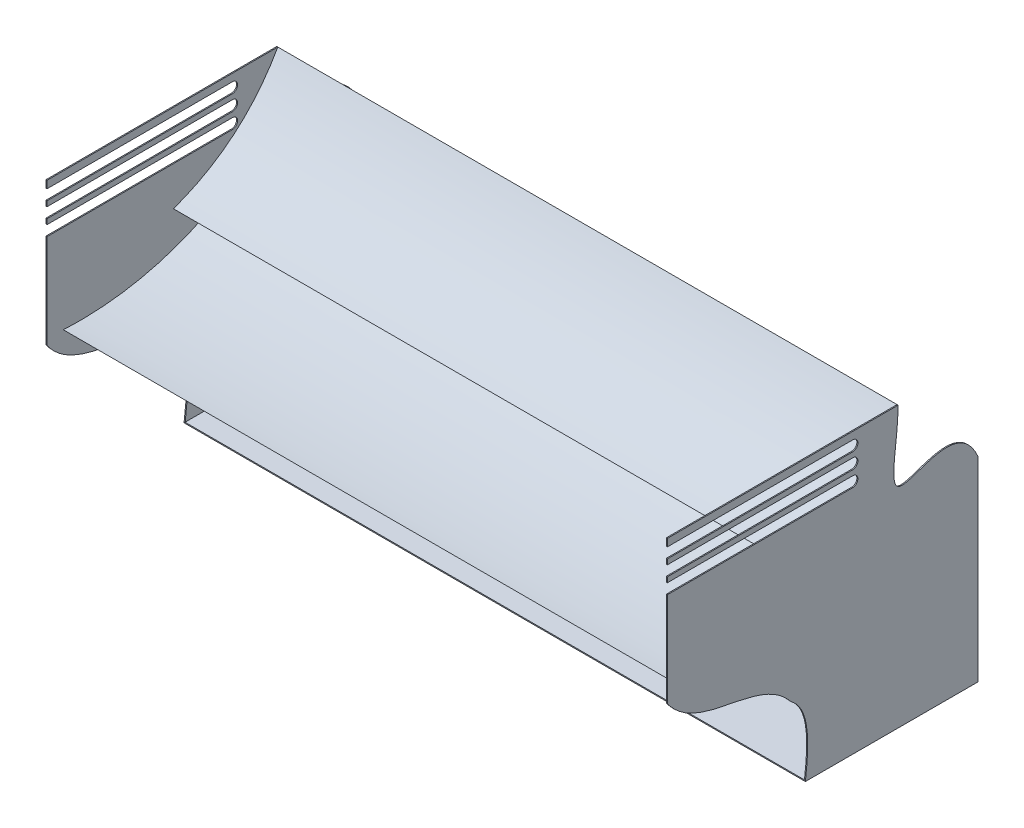
from build123d import *

# Parameters (mm, degrees)
BOSS_EXTRUDE1_START        = 762
BOSS_EXTRUDE1_DEPTH        = 2.54
BOSS_EXTRUDE3_DEPTH        = 759.46
BOSS_EXTRUDE3_DEPTH_BACK   = 762
BOSS_EXTRUDE3_2_DEPTH      = 759.46
BOSS_EXTRUDE3_2_DEPTH_BACK = 762
SKETCH13_W                 = 1524
SKETCH13_H                 = 423.429853573
BOSS_EXTRUDE4_DEPTH        = 2.54
CUT_EXTRUDE1_DEPTH         = 1278.344761778
CUT_EXTRUDE1_DEPTH_BACK    = 1278.344761778
CUT_EXTRUDE2_DEPTH         = 1278.344761778
CUT_EXTRUDE2_DEPTH_BACK    = 1278.344761778


with BuildPart() as part:
    # Sketch3 → Boss-Extrude1 (new body)
    with BuildSketch(Plane(origin=(0, 0, 0), x_dir=(0, 0, -1), z_dir=(1, 0, 0)).offset(BOSS_EXTRUDE1_START)):
        with BuildLine():
            Line((338.570146427, 0), (762, 0))
            Line((762, 0), (762, 478.643823899))
            add(Edge.make_bspline(
                [(566.02119263, 685.8), (566.02119263, 609.562833411), (511.018643959, 418.064816879), (711.566045078, 596.214023542), (762, 478.643823899)],
                knots=[0, 0, 0, 0, 0.43337684, 1, 1, 1, 1], degree=3))
            Line((566.02119263, 685.8), (0, 685.8))
            Line((0, 685.8), (0, 216.97447871))
            add(Edge.make_bspline(
                [(0, 216.97447871), (268.153594246, 216.97447871), (370.795901917, 243.07894269), (338.570146427, 0)],
                knots=[0, 0, 0, 0, 1, 1, 1, 1], degree=3))
        make_face()
    extrude(amount=-BOSS_EXTRUDE1_DEPTH)


with BuildPart() as body_2:
    # Mirror1: mirrored copy
    add(part.part.mirror(Plane(origin=(0, 0, 0), x_dir=(0, 0, 1), z_dir=(1, 0, 0))))


with BuildPart() as body_3:
    # Sketch8 → Boss-Extrude3 (new, two sides: drawn at the far end of the back side and taken through both)
    with BuildSketch(Plane(origin=(0, 0, 0), x_dir=(0, 0, -1), z_dir=(1, 0, 0)).offset(-BOSS_EXTRUDE3_DEPTH_BACK)):
        with BuildLine():
            add(Edge.make_bspline(
                [(566.02119263, 685.8), (478.94605907, 530.59259106), (310.041791286, 470.260887435)],
                knots=[0, 0, 0, 1, 1, 1], degree=2))
            add(Edge.make_bspline(
                [(566.02119263, 685.8), (535.192963113, 473.791997419), (310.041791286, 470.260887435)],
                knots=[0, 0, 0, 1, 1, 1], degree=2))
        make_face()
    extrude(amount=BOSS_EXTRUDE3_DEPTH + BOSS_EXTRUDE3_DEPTH_BACK)


with BuildPart() as body_4:
    # Sketch8 → Boss-Extrude3 2 (new, two sides: drawn at the far end of the back side and taken through both)
    with BuildSketch(Plane(origin=(0, 0, 0), x_dir=(0, 0, -1), z_dir=(1, 0, 0)).offset(-BOSS_EXTRUDE3_2_DEPTH_BACK)):
        with BuildLine():
            add(Edge.make_bspline(
                [(493.805357443, 481.17753493), (291.820165627, 335.217986135), (39.854765798, 348.358323747)],
                knots=[0, 0, 0, 1, 1, 1], degree=2))
            add(Edge.make_bspline(
                [(493.805357443, 481.17753493), (323.598432885, 237.863082713), (39.854765798, 348.358323747)],
                knots=[0, 0, 0, 1, 1, 1], degree=2))
        make_face()
    extrude(amount=BOSS_EXTRUDE3_2_DEPTH + BOSS_EXTRUDE3_2_DEPTH_BACK)


with BuildPart() as part_1:
    add(part.part)

    add(body_2.part)  # Boss-Extrude4 merges body 2
    # Sketch13 → Boss-Extrude4 (add)
    with BuildSketch(Plane(origin=(0, 0, 0), x_dir=(1, 0, 0), z_dir=(0, 1, 0))):
        with Locations((0, 550.285073214)):
            Rectangle(SKETCH13_W, SKETCH13_H)
    extrude(amount=BOSS_EXTRUDE4_DEPTH)

    # Sketch16 → Cut-Extrude1 (cut, two sides: drawn at the far end of the back side and taken through both)
    with BuildSketch(Plane(origin=(0, 0, 0), x_dir=(0, 0, -1), z_dir=(1, 0, 0)).offset(-CUT_EXTRUDE1_DEPTH_BACK)):
        with BuildLine():
            Line((0, 667.670249742), (454.687424311, 667.670249742))
            ThreePointArc((454.687424311, 667.670249742), (467.387424311, 654.970249742), (454.687424311, 642.270249742))
            Line((454.687424311, 642.270249742), (0, 642.270249742))
            ThreePointArc((0, 642.270249742), (-12.7, 654.970249742), (0, 667.670249742))
        make_face()
        with BuildLine():
            Line((0, 604.170249742), (454.687424311, 604.170249742))
            ThreePointArc((454.687424311, 604.170249742), (467.387424311, 616.870249742), (454.687424311, 629.570249742))
            Line((454.687424311, 629.570249742), (0, 629.570249742))
            ThreePointArc((0, 629.570249742), (-12.7, 616.870249742), (0, 604.170249742))
        make_face()
        with BuildLine():
            Line((0, 566.070249742), (454.687424311, 566.070249742))
            ThreePointArc((454.687424311, 566.070249742), (467.387424311, 578.770249742), (454.687424311, 591.470249742))
            Line((454.687424311, 591.470249742), (0, 591.470249742))
            ThreePointArc((0, 591.470249742), (-12.7, 578.770249742), (0, 566.070249742))
        make_face()
    extrude(amount=CUT_EXTRUDE1_DEPTH + CUT_EXTRUDE1_DEPTH_BACK, mode=Mode.SUBTRACT)

    # Sketch17 → Cut-Extrude2 (cut, two sides: drawn at the far end of the back side and taken through both)
    with BuildSketch(Plane(origin=(0, 0, 0), x_dir=(0, 0, -1), z_dir=(1, 0, 0)).offset(-CUT_EXTRUDE2_DEPTH_BACK)):
        with BuildLine():
            Line((0, 334.71225841), (0, 103.643051311))
            Line((0, 103.643051311), (302.999558796, 187.654799067))
            add(Edge.make_bspline(
                [(302.999558796, 187.654799067), (225.21849282, 285.739628908), (76.800772912, 227.85117527), (0, 334.71225841)],
                knots=[0, 0, 0, 0, 1, 1, 1, 1], degree=3))
        make_face()
    extrude(amount=CUT_EXTRUDE2_DEPTH + CUT_EXTRUDE2_DEPTH_BACK, mode=Mode.SUBTRACT)


solid = Compound([body_3.part, body_4.part, part_1.part])
